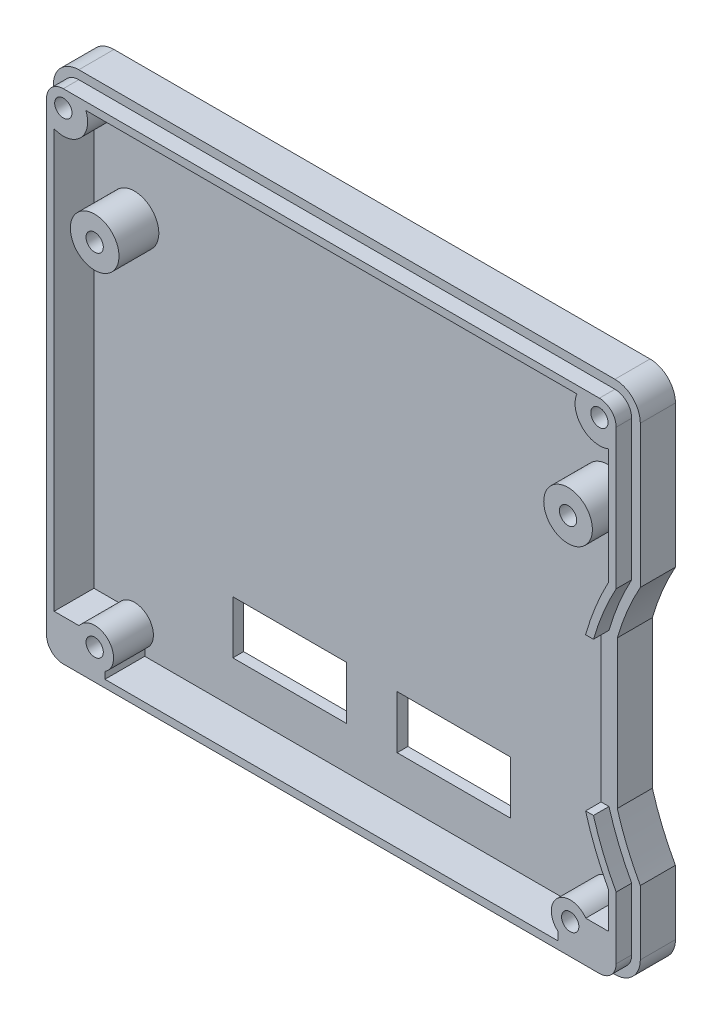
from build123d import *

# Parameters (mm, degrees)
SKETCH1_W                = 108.6
SKETCH1_H                = 95.4
BOSS_EXTRUDE1_DEPTH      = 6.5
FILLET1_R                = 4.7
CUT_EXTRUDE2_DEPTH       = 73.567416931
SHELL1_T                 = -3
SHELL1_THICKNESS_2_DEPTH = 1
SKETCH3_W                = 21
SKETCH3_H                = 9.8
CUT_EXTRUDE1_DEPTH       = 73.567416931
BOSS_EXTRUDE2_START      = 2.87
BOSS_EXTRUDE2_DEPTH      = 2.87
SKETCH6_R                = 1.6
CUT_EXTRUDE3_DEPTH       = 73.650512042
BOSS_EXTRUDE3_START      = 7.37
SKETCH7_R                = 4.5
SKETCH7_R_2              = 1.6
BOSS_EXTRUDE3_DEPTH      = 7.37


with BuildPart() as part:
    # Sketch1 → Boss-Extrude1 (new body)
    with BuildSketch(Plane.XY):
        Rectangle(SKETCH1_W, SKETCH1_H)
    extrude(amount=BOSS_EXTRUDE1_DEPTH)

    # Fillet1
    fillet1_edges = [part.edges().sort_by_distance(p)[0] for p in [
        (54.3, -47.7, 3.25),
        (-54.3, -47.7, 3.25),
        (-54.3, 47.7, 3.25),
        (54.3, 47.7, 3.25),
    ]]
    fillet(fillet1_edges, radius=FILLET1_R)

    # Sketch4 → Cut-Extrude2 (cut, through all)
    with BuildSketch(Plane.XY.offset(6.5)):
        with BuildLine():
            Line((50.037, 6.46747704), (50.037, -20.87017704))
            ThreePointArc((50.037, -20.87017704), (146.29602, -7.20135), (50.037, 6.46747704))
        make_face()
    extrude(amount=-CUT_EXTRUDE2_DEPTH, mode=Mode.SUBTRACT)

    # Shell1
    shell1_openings = [part.faces().sort_by_distance(p)[0] for p in [
        (-0.847501067, 0.116576538, 6.5),
    ]]
    offset(amount=SHELL1_T, openings=shell1_openings, kind=Kind.INTERSECTION)

    # Shell1 thickness 2 face (on inner face of the shell) → Shell1 thickness 2 (cut)
    with BuildSketch(Plane(origin=(-0.931808726, 0.135963236, 3), x_dir=(-1, 0, 0), z_dir=(0, 0, -1))):
        with BuildLine():
            ThreePointArc((50.368191274, -43.135963236), (49.870272802, -44.338044764), (48.668191274, -44.835963236))
            Line((48.668191274, -44.835963236), (-50.531808726, -44.835963236))
            ThreePointArc((-50.531808726, -44.835963236), (-51.733890254, -44.338044764), (-52.231808726, -43.135963236))
            Line((-52.231808726, -43.135963236), (-52.231808726, -31.994266579))
            ThreePointArc((-52.231808726, -31.994266579), (-49.810478696, -26.826892146), (-47.968808726, -21.425702521))
            Line((-47.968808726, -21.425702521), (-47.968808726, 6.751076049))
            ThreePointArc((-47.968808726, 6.751076049), (-49.810478696, 12.152265674), (-52.231808726, 17.319640107))
            Line((-52.231808726, 17.319640107), (-52.231808726, 42.864036764))
            ThreePointArc((-52.231808726, 42.864036764), (-51.733890254, 44.066118292), (-50.531808726, 44.564036764))
            Line((-50.531808726, 44.564036764), (48.668191274, 44.564036764))
            ThreePointArc((48.668191274, 44.564036764), (49.870272802, 44.066118292), (50.368191274, 42.864036764))
            Line((50.368191274, 42.864036764), (50.368191274, -43.135963236))
        make_face()
    extrude(amount=SHELL1_THICKNESS_2_DEPTH, mode=Mode.SUBTRACT)

    # Sketch3 → Cut-Extrude1 (cut, through all)
    with BuildSketch(Plane.XY.offset(6.5)):
        with Locations((-15.1, -31.9)):
            Rectangle(SKETCH3_W, SKETCH3_H)
        with Locations((15.3, -31.9)):
            Rectangle(SKETCH3_W, SKETCH3_H)
    extrude(amount=-CUT_EXTRUDE1_DEPTH, mode=Mode.SUBTRACT)

    # Sketch5 → Boss-Extrude2 (add)
    with BuildSketch(Plane.XY.offset(6.5).offset(BOSS_EXTRUDE2_START)):
        with BuildLine():
            Line((52.7, 17.100794024), (52.7, 43))
            ThreePointArc((52.7, 43), (51.792031022, 45.192031022), (49.6, 46.1))
            Line((49.6, 46.1), (-49.6, 46.1))
            ThreePointArc((-49.6, 46.1), (-51.792031022, 45.192031022), (-52.7, 43))
            Line((-52.7, 43), (-52.7, -43))
            ThreePointArc((-52.7, -43), (-51.792031022, -45.192031022), (-49.6, -46.1))
            Line((-49.6, -46.1), (49.6, -46.1))
            ThreePointArc((49.6, -46.1), (51.792031022, -45.192031022), (52.7, -43))
            Line((52.7, -43), (52.7, -31.503494024))
            ThreePointArc((52.7, -31.503494024), (50.322512039, -26.523985726), (48.500249857, -21.315597065))
            Line((48.500249857, -21.315597065), (47.044269983, -21.315597065))
            ThreePointArc((47.044269983, -21.315597065), (48.883695535, -26.70338335), (51.3, -31.858303343))
            Line((51.3, -31.858303343), (51.3, -43))
            ThreePointArc((51.3, -43), (50.802081528, -44.202081528), (49.6, -44.7))
            Line((49.6, -44.7), (-49.6, -44.7))
            ThreePointArc((-49.6, -44.7), (-50.802081528, -44.202081528), (-51.3, -43))
            Line((-51.3, -43), (-51.3, 43))
            ThreePointArc((-51.3, 43), (-50.802081528, 44.202081528), (-49.6, 44.7))
            Line((-49.6, 44.7), (49.6, 44.7))
            ThreePointArc((49.6, 44.7), (50.802081528, 44.202081528), (51.3, 43))
            Line((51.3, 43), (51.3, 17.455603343))
            ThreePointArc((51.3, 17.455603343), (48.883695535, 12.30068335), (47.044269983, 6.912897065))
            Line((47.044269983, 6.912897065), (48.500249857, 6.912897065))
            ThreePointArc((48.500249857, 6.912897065), (50.322512039, 12.121285726), (52.7, 17.100794024))
        make_face()
    extrude(amount=-BOSS_EXTRUDE2_DEPTH)

    # Sketch6 → Cut-Extrude3 (cut, through all)
    with BuildSketch(Plane.XY.offset(2)):
        with Locations((-49.6, 43)):
            Circle(SKETCH6_R)
        with Locations((-43.8, 24.4)):
            Circle(SKETCH6_R)
        with Locations((43.8, 24.4)):
            Circle(SKETCH6_R)
        with Locations((49.6, 43)):
            Circle(SKETCH6_R)
        with Locations((49.6, -43)):
            Circle(SKETCH6_R)
        with Locations((44.2, -40.5)):
            Circle(SKETCH6_R)
        with Locations((-49.6, -43)):
            Circle(SKETCH6_R)
        with Locations((-43.8, -40.5)):
            Circle(SKETCH6_R)
    extrude(amount=-CUT_EXTRUDE3_DEPTH, mode=Mode.SUBTRACT)

    # Sketch7 → Boss-Extrude3 (add)
    # profile 1 of 6: a face of its own
    with BuildSketch(Plane.XY.offset(2).offset(BOSS_EXTRUDE3_START)):
        with Locations(Location((-43.8, 24.4, 0), (0, 0, 180))):
            Circle(SKETCH7_R)
        with Locations((-43.8, 24.4)):
            Circle(SKETCH7_R_2, mode=Mode.SUBTRACT)
    # profile 2 of 6: a face of its own
    with BuildSketch(Plane.XY.offset(2).offset(BOSS_EXTRUDE3_START)):
        with Locations(Location((43.8, 24.4, 0), (0, 0, 180))):
            Circle(SKETCH7_R)
        with Locations((43.8, 24.4)):
            Circle(SKETCH7_R_2, mode=Mode.SUBTRACT)
    # profile 3 of 6: a face of its own
    with BuildSketch(Plane.XY.offset(2).offset(BOSS_EXTRUDE3_START)):
        with BuildLine():
            Line((47.072281323, -38.5), (51.3, -38.5))
            Line((51.3, -38.5), (51.3, -43))
            ThreePointArc((51.3, -43), (50.802081528, -44.202081528), (49.6, -44.7))
            Line((49.6, -44.7), (41.9, -44.7))
            Line((41.9, -44.7), (41.9, -43.138181192))
            ThreePointArc((41.9, -43.138181192), (41.863323371, -37.894248222), (47.072281323, -38.5))
        make_face()
        with Locations((44.2, -40.5)):
            Circle(SKETCH7_R_2, mode=Mode.SUBTRACT)
    # profile 4 of 6: a face of its own
    with BuildSketch(Plane.XY.offset(2).offset(BOSS_EXTRUDE3_START)):
        with BuildLine():
            Line((-49.6, -44.7), (-41.9, -44.7))
            Line((-41.9, -44.7), (-41.9, -43.439387691))
            ThreePointArc((-41.9, -43.439387691), (-41.282914297, -38.068070814), (-46.672281323, -38.5))
            Line((-46.672281323, -38.5), (-51.3, -38.5))
            Line((-51.3, -38.5), (-51.3, -43))
            ThreePointArc((-51.3, -43), (-50.802081528, -44.202081528), (-49.6, -44.7))
        make_face()
        with Locations((-43.8, -40.5)):
            Circle(SKETCH7_R_2, mode=Mode.SUBTRACT)
    # profile 5 of 6: a face of its own
    with BuildSketch(Plane.XY.offset(2).offset(BOSS_EXTRUDE3_START)):
        with BuildLine():
            Line((-49.6, 44.7), (-45.433466669, 44.7))
            ThreePointArc((-45.433466669, 44.7), (-46.418019485, 39.818019485), (-51.3, 38.833466669))
            Line((-51.3, 38.833466669), (-51.3, 43))
            ThreePointArc((-51.3, 43), (-50.802081528, 44.202081528), (-49.6, 44.7))
        make_face()
        with Locations((-49.6, 43)):
            Circle(SKETCH7_R_2, mode=Mode.SUBTRACT)
    # profile 6 of 6: a face of its own
    with BuildSketch(Plane.XY.offset(2).offset(BOSS_EXTRUDE3_START)):
        with BuildLine():
            Line((45.433466669, 44.7), (49.6, 44.7))
            ThreePointArc((49.6, 44.7), (50.802081528, 44.202081528), (51.3, 43))
            Line((51.3, 43), (51.3, 38.833466669))
            ThreePointArc((51.3, 38.833466669), (46.418019485, 39.818019485), (45.433466669, 44.7))
        make_face()
        with Locations((49.6, 43)):
            Circle(SKETCH7_R_2, mode=Mode.SUBTRACT)
    extrude(amount=-BOSS_EXTRUDE3_DEPTH)


solid = part.part
